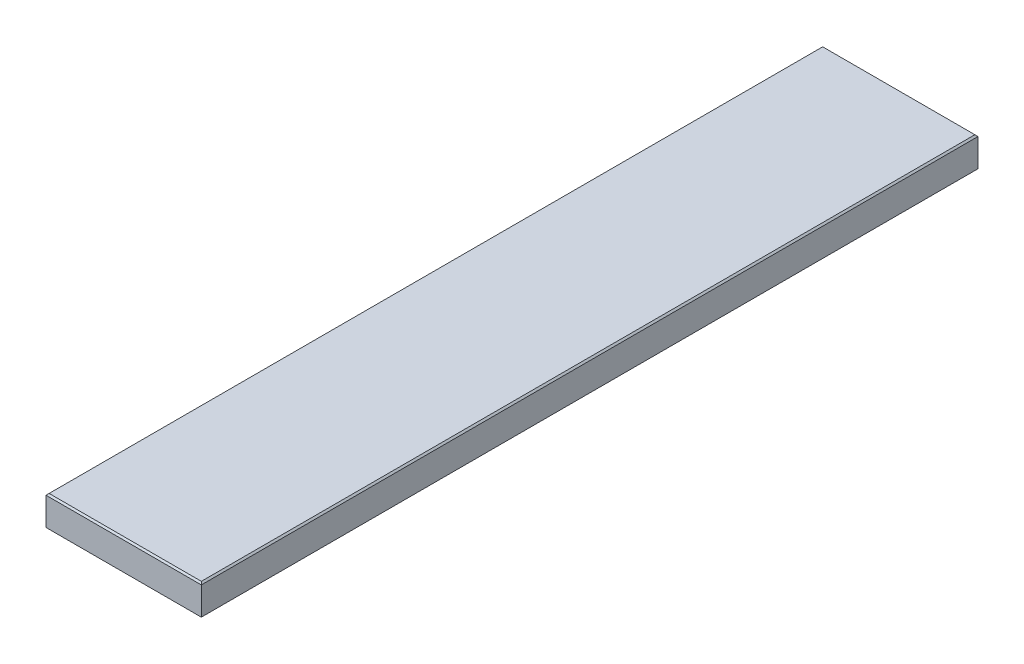
from build123d import *

# Parameters (mm, degrees)
SKETCH_1_W      = 20
SKETCH_1_H      = 100
EXTRUDE_1_DEPTH = 4
CHAMFER_1_SIZE  = 0.2


with BuildPart() as part:
    # 草图1 → 凸台-拉伸1 (new body)
    with BuildSketch(Plane(origin=(0, 0, 0), x_dir=(1, 0, 0), z_dir=(0, 1, 0))):
        with Locations((10, 50)):
            Rectangle(SKETCH_1_W, SKETCH_1_H)
    extrude(amount=EXTRUDE_1_DEPTH)

    # 倒角1
    chamfer_1_edges = [part.edges().sort_by_distance(p)[0] for p in [
        (20, 4, -50),
        (10, 4, -100),
        (0, 4, -50),
        (10, 0, -100),
        (20, 0, -50),
        (10, 0, 0),
        (0, 0, -50),
        (10, 4, 0),
    ]]
    chamfer(chamfer_1_edges, length=CHAMFER_1_SIZE)


solid = part.part
